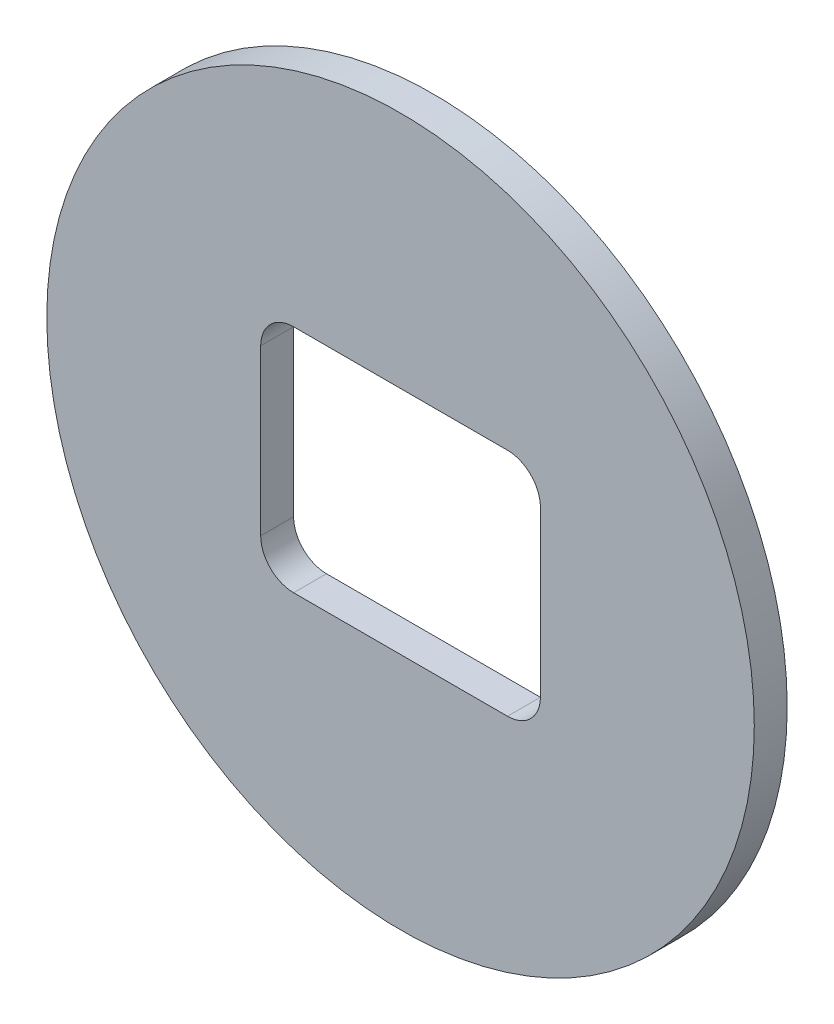
from build123d import *

# Parameters (mm, degrees)
SKETCH1_R           = 21.5
SKETCH1_W           = 17
SKETCH1_H           = 14
BOSS_EXTRUDE2_DEPTH = 2
FILLET1_R           = 2


with BuildPart() as part:
    # Sketch1 → Boss-Extrude2 (new body)
    with BuildSketch(Plane.XY):
        Circle(SKETCH1_R)
        Rectangle(SKETCH1_W, SKETCH1_H, mode=Mode.SUBTRACT)
    extrude(amount=BOSS_EXTRUDE2_DEPTH)

    # Fillet1
    fillet1_edges = [part.edges().sort_by_distance(p)[0] for p in [
        (8.5, -7, 1),
        (8.5, 7, 1),
        (-8.5, 7, 1),
        (-8.5, -7, 1),
    ]]
    fillet(fillet1_edges, radius=FILLET1_R)


solid = part.part
